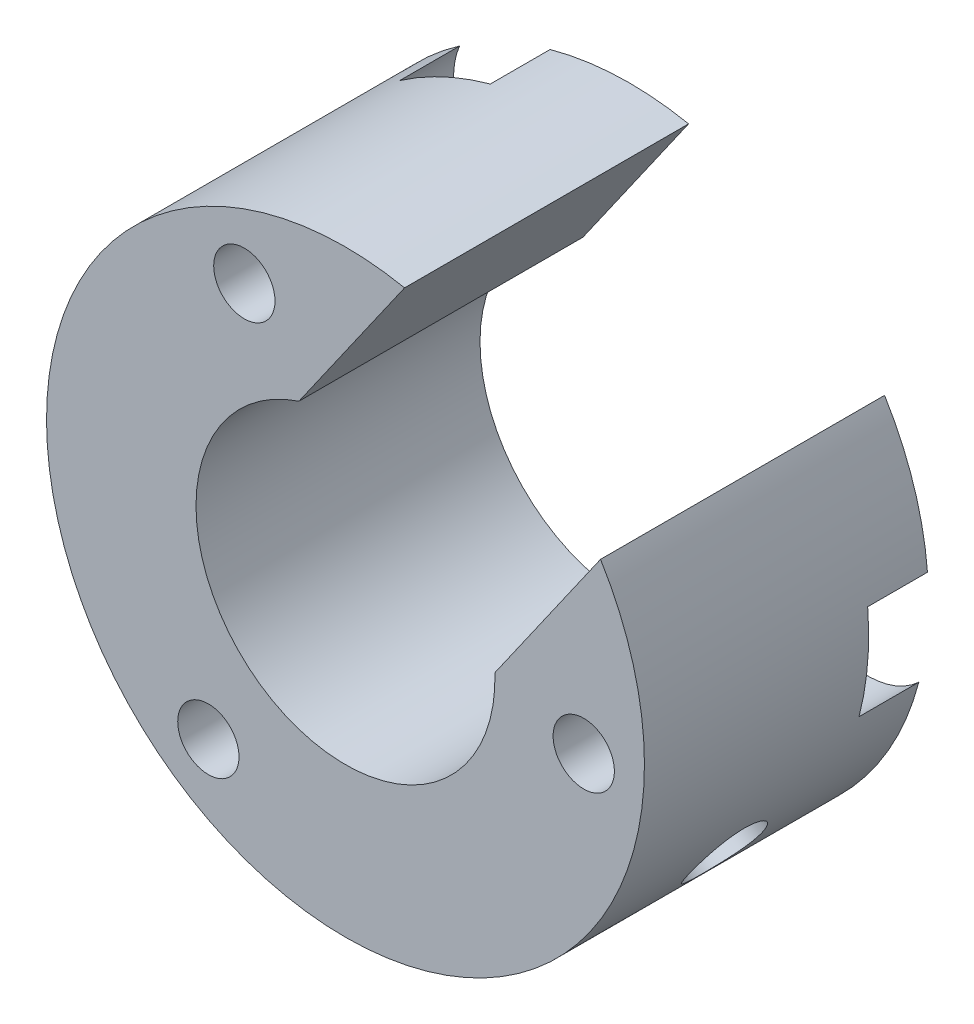
from build123d import *

# Parameters (mm, degrees)
BOSS_EXTRUDE2_DEPTH     = 9.5
CUT_EXTRUDE2_DEPTH      = 27.058535816
CUT_EXTRUDE2_DEPTH_BACK = 27.058535816
SKETCH5_R               = 1.25
SKETCH6_R               = 2.5
CUT_EXTRUDE9_DEPTH      = 2


with BuildPart() as part:
    # Sketch1 → Boss-Extrude2 (new body)
    with BuildSketch(Plane.XY):
        with BuildLine():
            ThreePointArc((-10.902610273, 5.618325714), (-9.358197978, 5.946861897), (-7.779340218, 5.965664362))
            Line((-7.779340218, 5.965664362), (-6.496881129, 7.798486163))
            ThreePointArc((-6.496881129, 7.798486163), (-14.207044336, -10.197524815), (0.057841359, 3.212026405))
            Line((0.057841359, 3.212026405), (-1.224617731, 1.379204604))
            ThreePointArc((-1.224617731, 1.379204604), (-0.701306814, -0.110523909), (-0.480783057, -1.674018275))
            ThreePointArc((-0.480783057, -1.674018275), (0.228827523, -1.982287772), (0.52081643, -2.698751126))
            ThreePointArc((0.52081643, -2.698751126), (0.163849564, -3.476154966), (-0.658416217, -3.71208093))
            ThreePointArc((-0.658416217, -3.71208093), (-5.090643329, -9.253473613), (-12.184684972, -9.091476058))
            ThreePointArc((-12.184684972, -9.091476058), (-13.648069553, -9.398668012), (-13.860882426, -7.918609902))
            ThreePointArc((-13.860882426, -7.918609902), (-16.443755706, -1.309492285), (-12.756440886, 4.753129216))
            ThreePointArc((-12.756440886, 4.753129216), (-12.290784632, 6.174053415), (-10.902610273, 5.618325714))
        make_face()
        with BuildLine():
            ThreePointArc((-3.476685985, -1.839330652), (-11.340506987, -6.10082326), (-10.031408473, 2.747129106))
            Line((-10.031408473, 2.747129106), (-7.779340218, 5.965664362))
            ThreePointArc((-7.779340218, 5.965664362), (-9.358197978, 5.946861897), (-10.902610273, 5.618325714))
            ThreePointArc((-10.902610273, 5.618325714), (-10.850027906, 5.435061947), (-10.832295948, 5.245230202))
            ThreePointArc((-10.832295948, 5.245230202), (-11.60332603, 4.252192297), (-12.756440886, 4.753129216))
            ThreePointArc((-12.756440886, 4.753129216), (-16.443755706, -1.309492285), (-13.860882426, -7.918609902))
            ThreePointArc((-13.860882426, -7.918609902), (-12.721194489, -7.591608608), (-12.035429397, -8.558844193))
            ThreePointArc((-12.035429397, -8.558844193), (-12.073448385, -8.835418744), (-12.184684972, -9.091476058))
            ThreePointArc((-12.184684972, -9.091476058), (-5.090643329, -9.253473613), (-0.658416217, -3.71208093))
            ThreePointArc((-0.658416217, -3.71208093), (-1.52531241, -2.609751731), (-0.480783057, -1.674018275))
            ThreePointArc((-0.480783057, -1.674018275), (-0.701306814, -0.110523909), (-1.224617731, 1.379204604))
            Line((-1.224617731, 1.379204604), (-3.476685985, -1.839330652))
        make_face()
    extrude(amount=BOSS_EXTRUDE2_DEPTH)

    # Sketch5 → Cut-Extrude2 (cut, two sides: drawn at the far end of the back side and taken through both)
    with BuildSketch(Plane(origin=(3.446074086, -2.411281355, 0), x_dir=(0, 0, -1), z_dir=(0.8193403109233307, -0.5733074697717271, 0)).offset(-CUT_EXTRUDE2_DEPTH_BACK)):
        with Locations(Location((-5, -6.500247794, 0), (0, 0, 90))):
            Circle(SKETCH5_R)
    extrude(amount=CUT_EXTRUDE2_DEPTH + CUT_EXTRUDE2_DEPTH_BACK, mode=Mode.SUBTRACT)

    # Sketch6 → Cut-Extrude9 (cut)
    with BuildSketch(Plane(origin=(0, 0, 0), x_dir=(-1, 0, 0), z_dir=(0, 0, -1))):
        with Locations((0.50418357, -2.698751126)):
            Circle(SKETCH6_R)
        with Locations((13.060429397, -8.558844193)):
            Circle(SKETCH6_R)
        with Locations((11.857295948, 5.245230202)):
            Circle(SKETCH6_R)
    extrude(amount=-CUT_EXTRUDE9_DEPTH, mode=Mode.SUBTRACT)


solid = part.part
